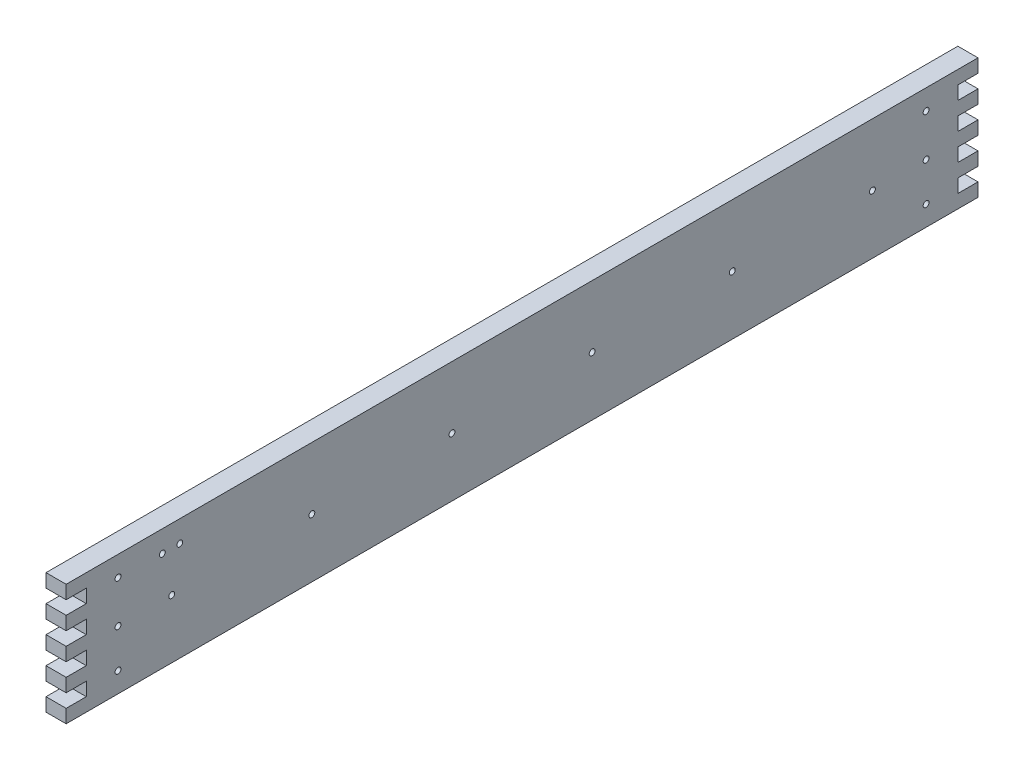
from build123d import *

# Parameters (mm, degrees)
BOSS_EXTRUDE1_DEPTH             = 19.05
F_7_32_0_21875_DIAMETER_HOLE2_D = 5.55625


with BuildPart() as part:
    # Sketch1 → Boss-Extrude1 (new body)
    with BuildSketch(Plane(origin=(0, 0, 0), x_dir=(0, 0, -1), z_dir=(1, 0, 0))):
        Polygon((0, 0), (862.33, 0), (862.33, 12.7), (843.28, 12.7), (843.28, 25.4), (862.33, 25.4), (862.33, 38.1), (843.28, 38.1), (843.28, 50.8), (862.33, 50.8), (862.33, 63.5), (843.28, 63.5), (843.28, 76.2), (862.33, 76.2), (862.33, 88.9), (843.28, 88.9), (843.28, 101.6), (862.33, 101.6), (862.33, 114.3), (0, 114.3), (0, 101.6), (19.05, 101.6), (19.05, 88.9), (0, 88.9), (0, 76.2), (19.05, 76.2), (19.05, 63.5), (0, 63.5), (0, 50.8), (19.05, 50.8), (19.05, 38.1), (0, 38.1), (0, 25.4), (19.05, 25.4), (19.05, 12.7), (0, 12.7), align=None)
    extrude(amount=BOSS_EXTRUDE1_DEPTH)

    # 7/32 (0.21875) Diameter Hole2 (through all)
    with Locations(Plane(origin=(19.05, 0, 0), x_dir=(0, 0, -1), z_dir=(1, 0, 0))):
        with Locations((49.0601, 55.499), (99.8601, 55.499), (232.38206, 55.499), (364.90402, 55.499), (497.42598, 55.499), (629.94794, 55.499), (762.4699, 55.499), (813.2699, 55.499), (813.2699, 95.25), (813.2699, 19.05), (49.0601, 95.25), (49.0601, 19.05), (90.968322508, 93.8784), (107.478322508, 93.8784)):
            Hole(F_7_32_0_21875_DIAMETER_HOLE2_D / 2)


solid = part.part
